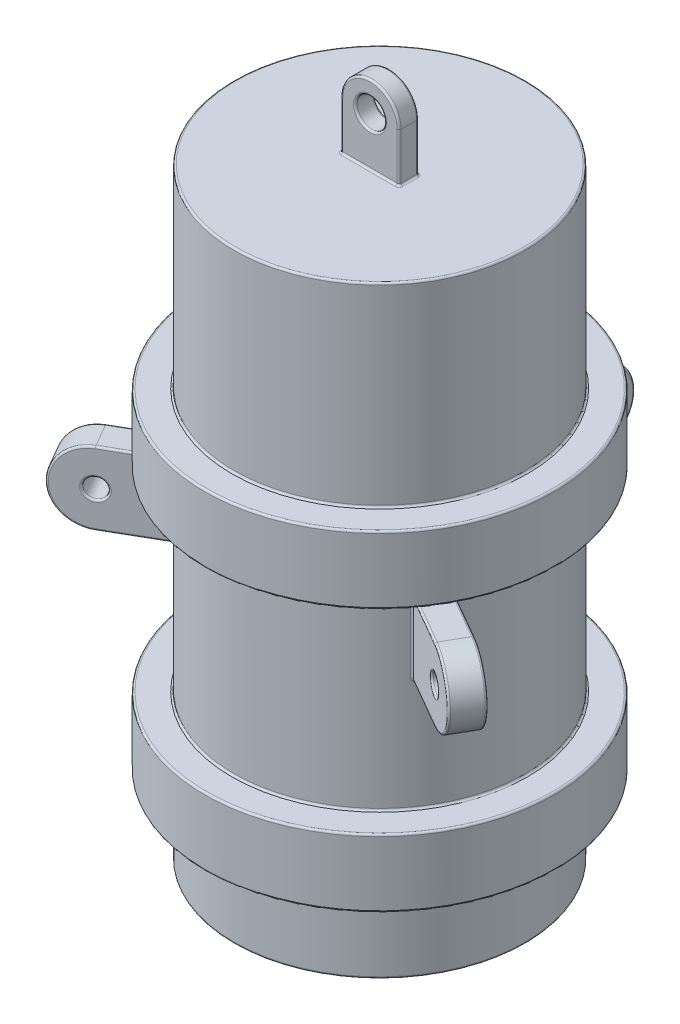
from build123d import *

# Parameters (mm, degrees)
SKETCH2_R           = 1.5
BOSS_EXTRUDE1_DEPTH = 1
SKETCH3_R           = 1
BOSS_EXTRUDE2_DEPTH = 1.5
CIRPATTERN1_COUNT   = 3
FILLET1_R           = 0.2


with BuildPart() as part:
    # Sketch1 → Revolve1 (revolve)
    with BuildSketch(Plane.XY, mode=Mode.PRIVATE) as revolve1_sk:
        Polygon((-4, 0), (-15, 0), (-15, 8), (-18, 8), (-18, 15), (-15, 15), (-15, 35), (-18, 35), (-18, 42), (-15, 42), (-15, 62), (0, 62), (0, 61), (-14, 61), (-14, 41), (-17, 41), (-17, 36), (-14, 36), (-14, 14), (-17, 14), (-17, 9), (-14, 9), (-14, 1), (-4, 1), align=None)
    revolve(revolve1_sk.sketch.rotate(Axis((0, 0, 0), (0, 1, 0)), 270), axis=Axis((0, 0, 0), (0, 1, 0)))

    # Sketch2 → Boss-Extrude1 (add, symmetric)
    with BuildSketch(Plane.XY):
        with BuildLine():
            Line((-3, 62), (3, 62))
            Line((3, 62), (3, 67))
            ThreePointArc((3, 67), (0, 70), (-3, 67))
            Line((-3, 67), (-3, 62))
        make_face()
        with Locations((0, 67)):
            Circle(SKETCH2_R, mode=Mode.SUBTRACT)
    extrude(amount=BOSS_EXTRUDE1_DEPTH, both=True)

    # Sketch3 → Boss-Extrude2 (add, symmetric)
    with BuildSketch(Plane(origin=(0, 0, 0), x_dir=(0, 0, -1), z_dir=(1, 0, 0))):
        with BuildLine():
            Line((14, 34), (21, 34))
            ThreePointArc((21, 34), (24.75, 30.25), (21, 26.5))
            Line((21, 26.5), (14, 26.5))
            Line((14, 26.5), (14, 34))
        make_face()
        with Locations((21, 30.25)):
            Circle(SKETCH3_R, mode=Mode.SUBTRACT)
    boss_extrude2 = extrude(amount=BOSS_EXTRUDE2_DEPTH, both=True)

    # CirPattern1: Boss-Extrude2 ×3 about axis
    cirpattern1_axis = Axis((0, 0, 0), (0, 1, 0))
    for i in range(1, CIRPATTERN1_COUNT):
        add(boss_extrude2.rotate(cirpattern1_axis, i * 360 / CIRPATTERN1_COUNT))

    # Fillet1
    fillet1_edges = [part.edges().sort_by_distance(p)[0] for p in [
        (13.675265955, 30.25, 6.163367673),
        (12.175265955, 30.25, 8.761443884),
        (14.805899717, 34, 10.280240995),
        (14.805899717, 26.5, 10.280240995),
        (20.684128744, 30.25, 13.674038106),
        (18.070508076, 30.25, 8.700961894),
        (12.990381057, 26.5, 7.5),
        (16.305899717, 26.5, 7.682164783),
        (16.305899717, 34, 7.682164783),
        (12.990381057, 34, 7.5),
        (22.184128744, 30.25, 11.075961894),
        (16.570508076, 30.25, 11.299038106),
        (-12.175265955, 30.25, 8.761443884),
        (-13.675265955, 30.25, 6.163367673),
        (-16.305899717, 34, 7.682164783),
        (-16.305899717, 26.5, 7.682164783),
        (-22.184128744, 30.25, 11.075961894),
        (-16.570508076, 30.25, 11.299038106),
        (-12.990381057, 26.5, 7.5),
        (-14.805899717, 26.5, 10.280240995),
        (-14.805899717, 34, 10.280240995),
        (-12.990381057, 34, 7.5),
        (-20.684128744, 30.25, 13.674038106),
        (-18.070508076, 30.25, 8.700961894),
        (0, 61, 14),
        (0, 41, 14),
        (0, 41, 17),
        (0, 36, 17),
        (0, 36, 14),
        (0, 14, 14),
        (0, 14, 17),
        (0, 9, 17),
        (0, 9, 14),
        (0, 1, 14),
        (0, 1, 4),
        (0, 0, 4),
        (0, 0, 15),
        (0, 8, 15),
        (0, 8, 18),
        (0, 15, 18),
        (0, 15, 15),
        (0, 35, 15),
        (0, 35, 18),
        (0, 42, 18),
        (0, 42, 15),
        (0, 62, 15),
        (-3, 64.5, 1),
        (0, 62, 1),
        (3, 64.5, 1),
        (0, 70, 1),
        (-1.5, 67, -1),
        (-3, 64.5, -1),
        (0, 62, -1),
        (-3, 62, 0),
        (3, 64.5, -1),
        (3, 62, 0),
        (0, 70, -1),
        (-1.5, 67, 1),
        (-1.5, 30.25, -14.924811557),
        (1.5, 30.25, -14.924811557),
        (1.5, 34, -17.962405778),
        (1.5, 26.5, -17.962405778),
        (1.5, 30.25, -24.75),
        (-1.5, 30.25, -20),
        (-0.750941626, 26.5, -14.981191097),
        (-1.5, 26.5, -17.962405778),
        (-1.5, 34, -17.962405778),
        (-0.750941626, 34, -14.981191097),
        (-1.5, 30.25, -24.75),
        (1.5, 30.25, -20),
    ]]
    fillet(fillet1_edges, radius=FILLET1_R)


solid = part.part
